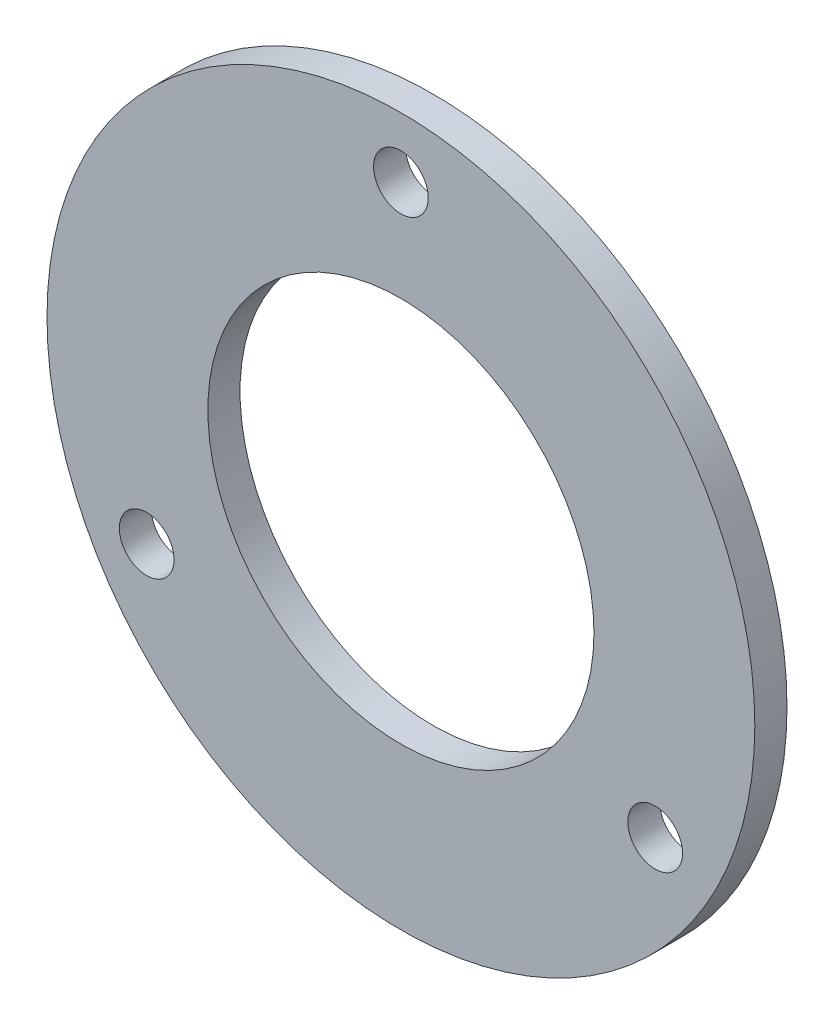
from build123d import *

# Parameters (mm, degrees)
S01_OUTER_RACE_RETAINING_LIP_R          = 22
S01_OUTER_RACE_RETAINING_LIP_R_2        = 12
F_01_OUTER_RACE_RETAINING_LIP_DEPTH     = 2
F_02_START                              = -1
S02_THREE_ACCESSIBLE_SCREW_HOLES_R      = 1.7
F_02_THREE_ACCESSIBLE_SCREW_HOLES_DEPTH = 4


with BuildPart() as part:
    # S01 - Outer race retaining lip → 01 - Outer race retaining lip (new body)
    with BuildSketch(Plane.XY):
        Circle(S01_OUTER_RACE_RETAINING_LIP_R)
        Circle(S01_OUTER_RACE_RETAINING_LIP_R_2, mode=Mode.SUBTRACT)
    extrude(amount=F_01_OUTER_RACE_RETAINING_LIP_DEPTH)

    # S02 - Three accessible screw holes → 02 - Three accessible screw holes (cut)
    with BuildSketch(Plane.XY.offset(F_02_START)):
        with Locations((0, 18.25)):
            Circle(S02_THREE_ACCESSIBLE_SCREW_HOLES_R)
        with Locations((-15.804963619, -9.125)):
            Circle(S02_THREE_ACCESSIBLE_SCREW_HOLES_R)
        with Locations((15.804963619, -9.125)):
            Circle(S02_THREE_ACCESSIBLE_SCREW_HOLES_R)
    extrude(amount=F_02_THREE_ACCESSIBLE_SCREW_HOLES_DEPTH, mode=Mode.SUBTRACT)


solid = part.part
